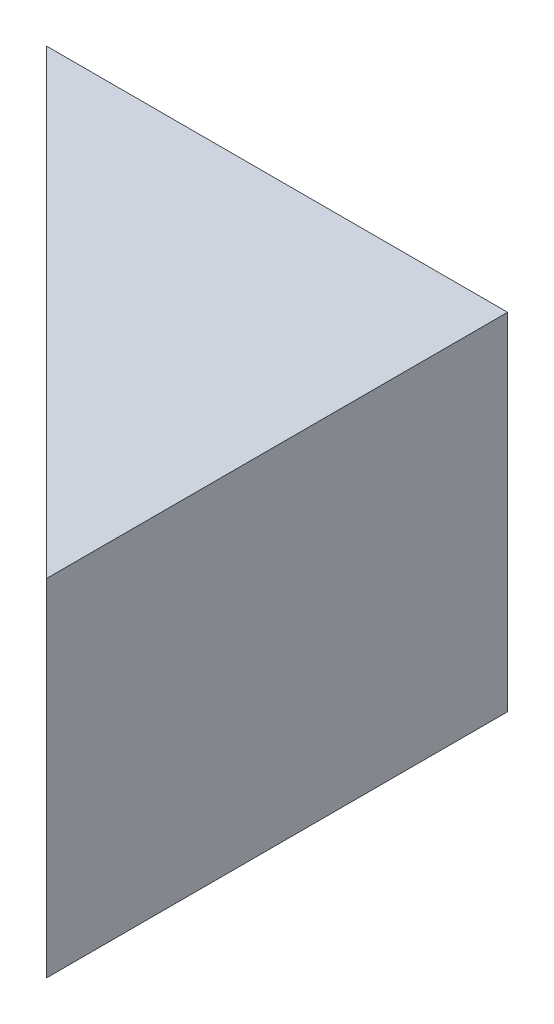
from build123d import *

# Parameters (mm, degrees)
AUFSATZ_LINEAR_AUSTRAGEN1_DEPTH = 7.5


with BuildPart() as part:
    # Skizze1 → Aufsatz-Linear austragen1 (new, symmetric)
    with BuildSketch(Plane(origin=(0, 0, 0), x_dir=(-1, 0, 0), z_dir=(0, 1, 0))):
        Polygon((0, 0), (20, 0), (0, 20), align=None)
    extrude(amount=AUFSATZ_LINEAR_AUSTRAGEN1_DEPTH, both=True)


solid = part.part
